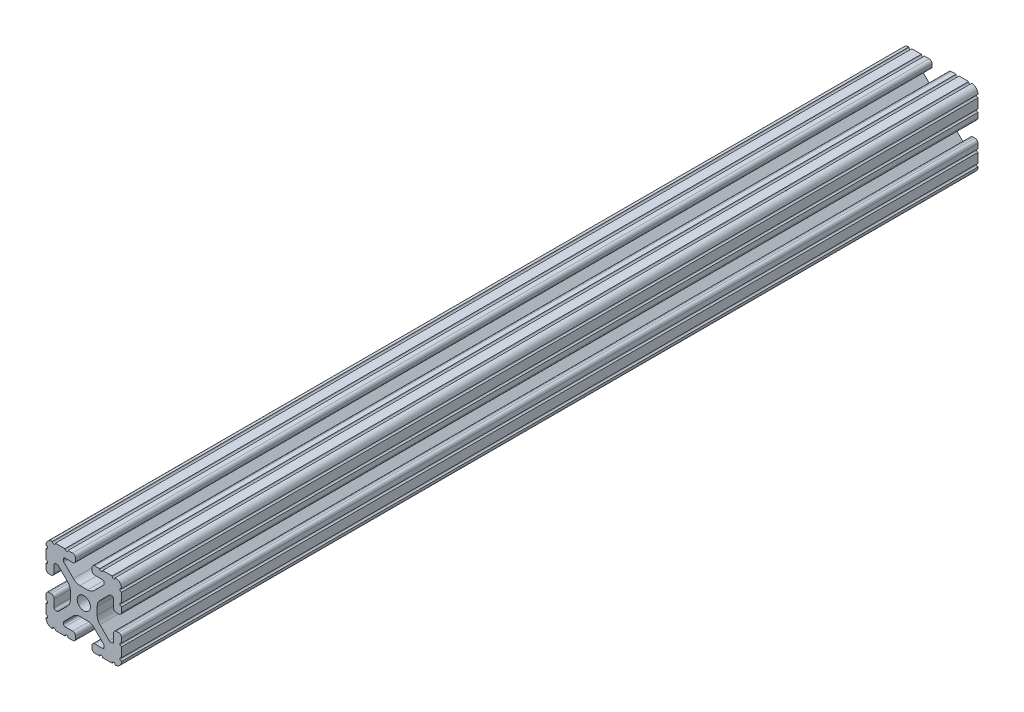
from build123d import *

# Parameters (mm, degrees)
SKETCH1_R      = 3.3274
EXTRUDE1_DEPTH = 431.8


with BuildPart() as part:
    # Sketch1 → Extrude1 (new body)
    with BuildSketch(Plane.XY):
        with BuildLine():
            Line((-10.022898969, 12.91475973), (-5.252158105, 8.144007132))
            ThreePointArc((-5.252158105, 8.144007132), (-3.715177372, 7.117027388), (-1.902183975, 6.7564))
            Line((-1.902183975, 6.7564), (1.902183975, 6.7564))
            ThreePointArc((1.902183975, 6.7564), (3.715177372, 7.117027388), (5.252158105, 8.144007132))
            Line((5.252158105, 8.144007132), (10.022898969, 12.91475973))
            ThreePointArc((10.022898969, 12.91475973), (10.218362387, 13.207291992), (10.287, 13.552357131))
            Line((10.287, 13.552357131), (10.287, 14.0843))
            ThreePointArc((10.287, 14.0843), (10.022898185, 14.721898185), (9.3853, 14.986))
            Line((9.3853, 14.986), (5.617617549, 14.986))
            ThreePointArc((5.617617549, 14.986), (4.519044045, 15.441044045), (4.064, 16.539617549))
            Line((4.064, 16.539617549), (4.064, 17.496382451))
            ThreePointArc((4.064, 17.496382451), (4.519044045, 18.594955955), (5.617617549, 19.05))
            Line((5.617617549, 19.05), (7.974178704, 19.05))
            ThreePointArc((7.974178704, 19.05), (8.736178704, 18.288), (9.498178704, 19.05))
            Line((9.498178704, 19.05), (14.327719207, 19.05))
            ThreePointArc((14.327719207, 19.05), (15.087603123, 18.231251131), (15.847487039, 19.05))
            ThreePointArc((15.847487039, 19.05), (18.120176289, 18.120192083), (19.05, 15.847509295))
            ThreePointArc((19.05, 15.847509295), (18.231250992, 15.08762539), (19.05, 14.327741484))
            Line((19.05, 14.327741484), (19.05, 9.496091471))
            ThreePointArc((19.05, 9.496091471), (18.231250992, 8.736207565), (19.05, 7.97632366))
            Line((19.05, 7.97632366), (19.05, 5.617617549))
            ThreePointArc((19.05, 5.617617549), (18.594955955, 4.519044045), (17.496382451, 4.064))
            Line((17.496382451, 4.064), (16.539617549, 4.064))
            ThreePointArc((16.539617549, 4.064), (15.441044045, 4.519044045), (14.986, 5.617617549))
            Line((14.986, 5.617617549), (14.986, 9.385342516))
            ThreePointArc((14.986, 9.385342516), (14.721898185, 10.022940701), (14.0843, 10.287042516))
            Line((14.0843, 10.287042516), (13.516042086, 10.287042516))
            ThreePointArc((13.516042086, 10.287042516), (13.170975923, 10.218404478), (12.878443117, 10.022939917))
            Line((12.878443117, 10.022939917), (8.14758008, 5.292065243))
            ThreePointArc((8.14758008, 5.292065243), (7.117955879, 3.751120653), (6.7564, 1.933453584))
            Line((6.7564, 1.933453584), (6.7564, -1.933453584))
            ThreePointArc((6.7564, -1.933453584), (7.117955879, -3.751120653), (8.14758008, -5.292065243))
            Line((8.14758008, -5.292065243), (12.878443117, -10.022939917))
            ThreePointArc((12.878443117, -10.022939917), (13.170975923, -10.218404478), (13.516042086, -10.287042516))
            Line((13.516042086, -10.287042516), (14.0843, -10.287042516))
            ThreePointArc((14.0843, -10.287042516), (14.721898185, -10.022940701), (14.986, -9.385342516))
            Line((14.986, -9.385342516), (14.986, -5.617617549))
            ThreePointArc((14.986, -5.617617549), (15.441044045, -4.519044045), (16.539617549, -4.064))
            Line((16.539617549, -4.064), (17.496382451, -4.064))
            ThreePointArc((17.496382451, -4.064), (18.594955955, -4.519044045), (19.05, -5.617617549))
            Line((19.05, -5.617617549), (19.05, -7.976318491))
            ThreePointArc((19.05, -7.976318491), (18.231250992, -8.736202396), (19.05, -9.496086302))
            Line((19.05, -9.496086302), (19.05, -14.32774291))
            ThreePointArc((19.05, -14.32774291), (18.231250992, -15.087626816), (19.05, -15.847510721))
            ThreePointArc((19.05, -15.847510721), (18.120175716, -18.120192644), (15.847486868, -19.05))
            ThreePointArc((15.847486868, -19.05), (15.087602952, -18.231251131), (14.327719036, -19.05))
            Line((14.327719036, -19.05), (9.496062448, -19.05))
            ThreePointArc((9.496062448, -19.05), (8.736178532, -18.231251131), (7.976294616, -19.05))
            Line((7.976294616, -19.05), (5.617617549, -19.05))
            ThreePointArc((5.617617549, -19.05), (4.519044045, -18.594955955), (4.064, -17.496382451))
            Line((4.064, -17.496382451), (4.064, -16.539617549))
            ThreePointArc((4.064, -16.539617549), (4.519044045, -15.441044045), (5.617617549, -14.986))
            Line((5.617617549, -14.986), (9.3853, -14.986))
            ThreePointArc((9.3853, -14.986), (10.022898185, -14.721898185), (10.287, -14.0843))
            Line((10.287, -14.0843), (10.287, -13.552357131))
            ThreePointArc((10.287, -13.552357131), (10.218362387, -13.207291992), (10.022898969, -12.91475973))
            Line((10.022898969, -12.91475973), (5.252158105, -8.144007132))
            ThreePointArc((5.252158105, -8.144007132), (3.715177372, -7.117027388), (1.902183975, -6.7564))
            Line((1.902183975, -6.7564), (-1.902183975, -6.7564))
            ThreePointArc((-1.902183975, -6.7564), (-3.715177372, -7.117027388), (-5.252158105, -8.144007132))
            Line((-5.252158105, -8.144007132), (-10.022898969, -12.91475973))
            ThreePointArc((-10.022898969, -12.91475973), (-10.218362387, -13.207291992), (-10.287, -13.552357131))
            Line((-10.287, -13.552357131), (-10.287, -14.0843))
            ThreePointArc((-10.287, -14.0843), (-10.022898185, -14.721898185), (-9.3853, -14.986))
            Line((-9.3853, -14.986), (-5.617617549, -14.986))
            ThreePointArc((-5.617617549, -14.986), (-4.519044045, -15.441044045), (-4.064, -16.539617549))
            Line((-4.064, -16.539617549), (-4.064, -17.496382451))
            ThreePointArc((-4.064, -17.496382451), (-4.519044045, -18.594955955), (-5.617617549, -19.05))
            Line((-5.617617549, -19.05), (-7.976294616, -19.05))
            ThreePointArc((-7.976294616, -19.05), (-8.736178532, -18.231251131), (-9.496062448, -19.05))
            Line((-9.496062448, -19.05), (-14.327719036, -19.05))
            ThreePointArc((-14.327719036, -19.05), (-15.087602952, -18.231251131), (-15.847486868, -19.05))
            ThreePointArc((-15.847486868, -19.05), (-18.120175716, -18.120192644), (-19.05, -15.847510721))
            ThreePointArc((-19.05, -15.847510721), (-18.231250992, -15.087626816), (-19.05, -14.32774291))
            Line((-19.05, -14.32774291), (-19.05, -9.496086302))
            ThreePointArc((-19.05, -9.496086302), (-18.231250992, -8.736202396), (-19.05, -7.976318491))
            Line((-19.05, -7.976318491), (-19.05, -5.617617549))
            ThreePointArc((-19.05, -5.617617549), (-18.594955955, -4.519044045), (-17.496382451, -4.064))
            Line((-17.496382451, -4.064), (-16.539617549, -4.064))
            ThreePointArc((-16.539617549, -4.064), (-15.441044045, -4.519044045), (-14.986, -5.617617549))
            Line((-14.986, -5.617617549), (-14.986, -9.385342516))
            ThreePointArc((-14.986, -9.385342516), (-14.721898185, -10.022940701), (-14.0843, -10.287042516))
            Line((-14.0843, -10.287042516), (-13.516042086, -10.287042516))
            ThreePointArc((-13.516042086, -10.287042516), (-13.170975923, -10.218404478), (-12.878443117, -10.022939917))
            Line((-12.878443117, -10.022939917), (-8.14758008, -5.292065243))
            ThreePointArc((-8.14758008, -5.292065243), (-7.117955879, -3.751120653), (-6.7564, -1.933453584))
            Line((-6.7564, -1.933453584), (-6.7564, 1.933453584))
            ThreePointArc((-6.7564, 1.933453584), (-7.117955879, 3.751120653), (-8.14758008, 5.292065243))
            Line((-8.14758008, 5.292065243), (-12.878443117, 10.022939917))
            ThreePointArc((-12.878443117, 10.022939917), (-13.170975923, 10.218404478), (-13.516042086, 10.287042516))
            Line((-13.516042086, 10.287042516), (-14.0843, 10.287042516))
            ThreePointArc((-14.0843, 10.287042516), (-14.721898185, 10.022940701), (-14.986, 9.385342516))
            Line((-14.986, 9.385342516), (-14.986, 5.617617549))
            ThreePointArc((-14.986, 5.617617549), (-15.441044045, 4.519044045), (-16.539617549, 4.064))
            Line((-16.539617549, 4.064), (-17.496382451, 4.064))
            ThreePointArc((-17.496382451, 4.064), (-18.594955955, 4.519044045), (-19.05, 5.617617549))
            Line((-19.05, 5.617617549), (-19.05, 7.97632366))
            ThreePointArc((-19.05, 7.97632366), (-18.231250992, 8.736207565), (-19.05, 9.496091471))
            Line((-19.05, 9.496091471), (-19.05, 14.327741484))
            ThreePointArc((-19.05, 14.327741484), (-18.231250992, 15.08762539), (-19.05, 15.847509295))
            ThreePointArc((-19.05, 15.847509295), (-18.120176289, 18.120192083), (-15.847487039, 19.05))
            ThreePointArc((-15.847487039, 19.05), (-15.087603123, 18.231251131), (-14.327719207, 19.05))
            Line((-14.327719207, 19.05), (-9.498178704, 19.05))
            ThreePointArc((-9.498178704, 19.05), (-8.736178704, 18.288), (-7.974178704, 19.05))
            Line((-7.974178704, 19.05), (-5.617617549, 19.05))
            ThreePointArc((-5.617617549, 19.05), (-4.519044045, 18.594955955), (-4.064, 17.496382451))
            Line((-4.064, 17.496382451), (-4.064, 16.539617549))
            ThreePointArc((-4.064, 16.539617549), (-4.519044045, 15.441044045), (-5.617617549, 14.986))
            Line((-5.617617549, 14.986), (-9.3853, 14.986))
            ThreePointArc((-9.3853, 14.986), (-10.022898185, 14.721898185), (-10.287, 14.0843))
            Line((-10.287, 14.0843), (-10.287, 13.552357131))
            ThreePointArc((-10.287, 13.552357131), (-10.218362387, 13.207291992), (-10.022898969, 12.91475973))
        make_face()
        Circle(SKETCH1_R, mode=Mode.SUBTRACT)
    extrude(amount=-EXTRUDE1_DEPTH)


solid = part.part
